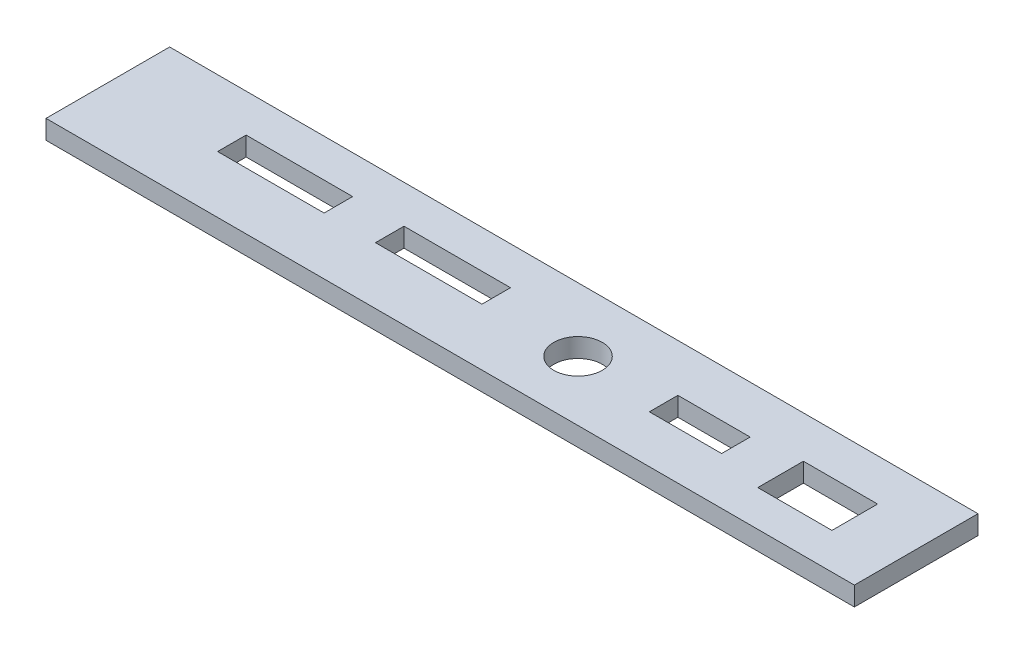
from build123d import *

# Parameters (mm, degrees)
SKETCH_1_W      = 85
SKETCH_1_H      = 13
SKETCH_1_R      = 2.55
SKETCH_1_W_2    = 7.8
SKETCH_1_H_2    = 4.8
SKETCH_1_W_3    = 7.6
SKETCH_1_H_3    = 3
SKETCH_1_W_4    = 11.2
EXTRUDE_2_DEPTH = 2


with BuildPart() as part:
    # 草图1 → 凸台-拉伸2 (new body)
    with BuildSketch(Plane(origin=(0, 0, 0), x_dir=(1, 0, 0), z_dir=(0, 1, 0))):
        with Locations((32.448630137, -1.668848032)):
            Rectangle(SKETCH_1_W, SKETCH_1_H)
        with Locations(Location((39.591348171, -1.868848032, 0), (0, 0, 270))):
            Circle(SKETCH_1_R, mode=Mode.SUBTRACT)
        with Locations((64.891348171, -1.968848032)):
            Rectangle(SKETCH_1_W_2, SKETCH_1_H_2, mode=Mode.SUBTRACT)
        with Locations((52.191348171, -1.668848032)):
            Rectangle(SKETCH_1_W_3, SKETCH_1_H_3, mode=Mode.SUBTRACT)
        with Locations((24.191348171, -0.668848032)):
            Rectangle(SKETCH_1_W_4, SKETCH_1_H_3, mode=Mode.SUBTRACT)
        with Locations((7.591348171, -0.668848032)):
            Rectangle(SKETCH_1_W_4, SKETCH_1_H_3, mode=Mode.SUBTRACT)
    extrude(amount=EXTRUDE_2_DEPTH)


solid = part.part
